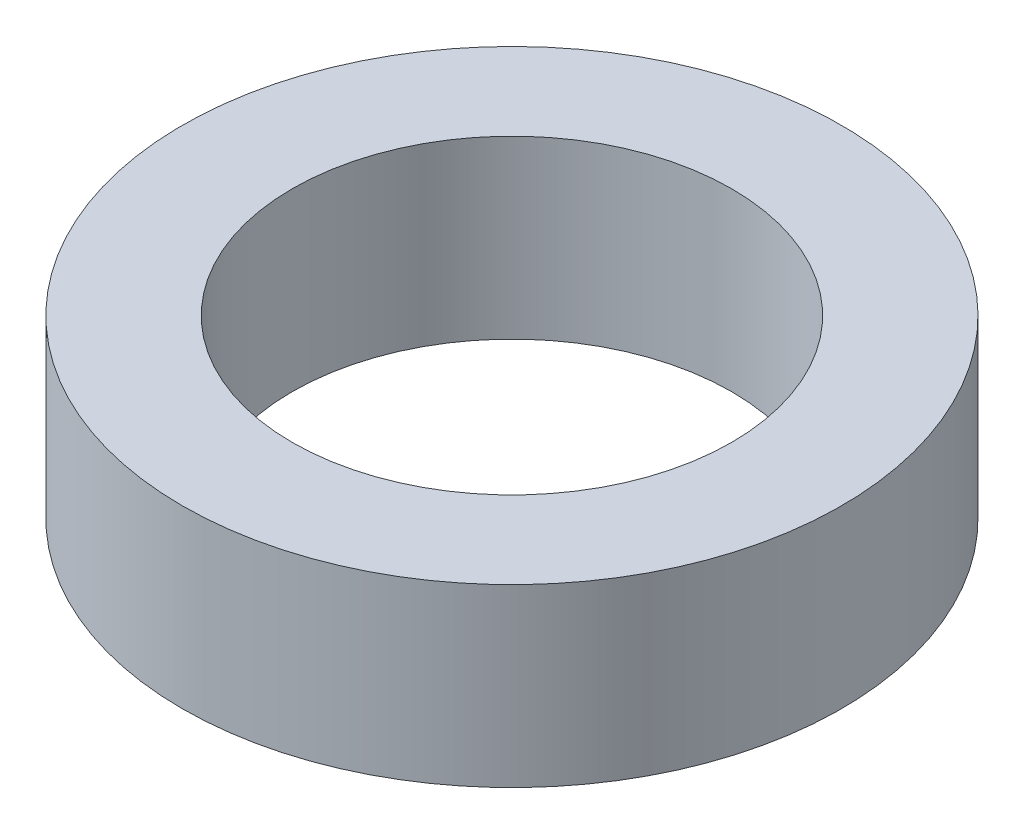
from build123d import *

# Parameters (mm, degrees)
SKETCH1_R           = 7.5
SKETCH1_R_2         = 5
BOSS_EXTRUDE1_DEPTH = 4


with BuildPart() as part:
    # Sketch1 → Boss-Extrude1 (new body)
    with BuildSketch(Plane(origin=(0, 0, 0), x_dir=(1, 0, 0), z_dir=(0, 1, 0))):
        with Locations(Location((0, 0, 0), (0, 0, 270))):
            Circle(SKETCH1_R)
        with Locations(Location((0, 0, 0), (0, 0, 270))):
            Circle(SKETCH1_R_2, mode=Mode.SUBTRACT)
    extrude(amount=BOSS_EXTRUDE1_DEPTH)


solid = part.part
